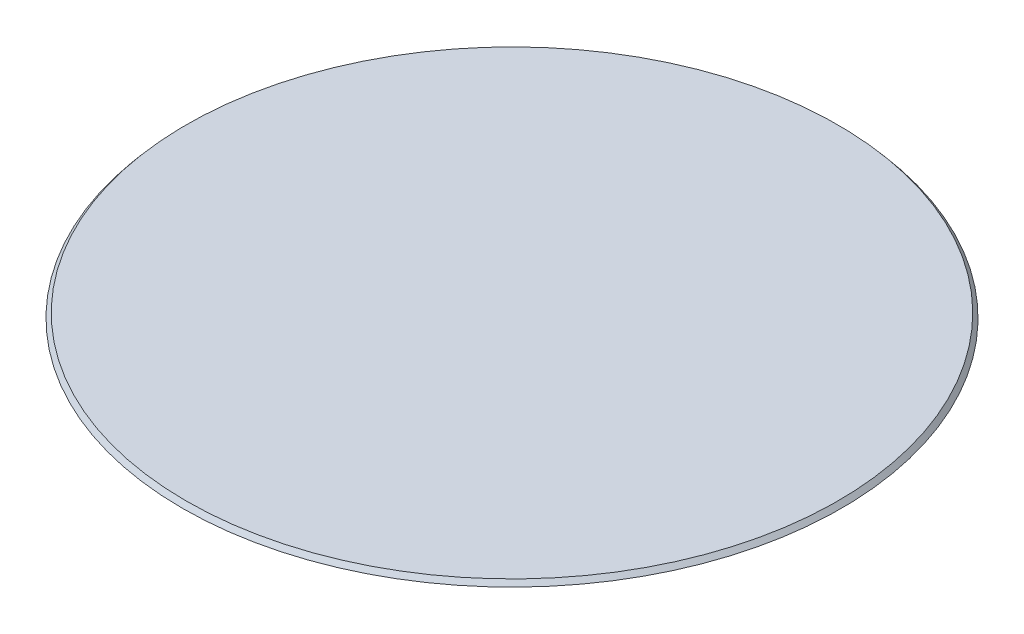
from build123d import *

# Parameters (mm, degrees)
BOSS_EXTRUDE1_DEPTH = 4
CIRPATTERN1_COUNT   = 5


with BuildPart() as part:
    # Sketch1 → Revolve1 (revolve)
    with BuildSketch(Plane(origin=(0, 0, 0), x_dir=(0, 0, -1), z_dir=(1, 0, 0))):
        Polygon((0, 0), (29.164360148, 0), (29.5, -0.4), (26.2, -1.9), (26.2, -0.9), (22.1, -0.9), (22.1, -1.9), (0, -1.9), align=None)
    revolve(axis=Axis((0, 64.33779776, 0), (0, -1, 0)))

    # Sketch2 → Boss-Extrude1 (add)
    with BuildSketch(Plane.XZ.offset(1.9)):
        with BuildLine():
            Line((9.35, 18.243560508), (3.85, 13.033927997))
            ThreePointArc((3.85, 13.033927997), (0, 11.5), (-3.85, 13.033927997))
            Line((-3.85, 13.033927997), (-9.35, 18.243560508))
            ThreePointArc((-9.35, 18.243560508), (0, 20.5), (9.35, 18.243560508))
        make_face()
    boss_extrude1 = extrude(amount=BOSS_EXTRUDE1_DEPTH)

    # CirPattern1: Boss-Extrude1 ×5 about axis
    cirpattern1_axis = Axis((0, 64.33779776, 0), (0, -1, 0))
    for i in range(1, CIRPATTERN1_COUNT):
        add(boss_extrude1.rotate(cirpattern1_axis, i * 360 / CIRPATTERN1_COUNT))


solid = part.part
